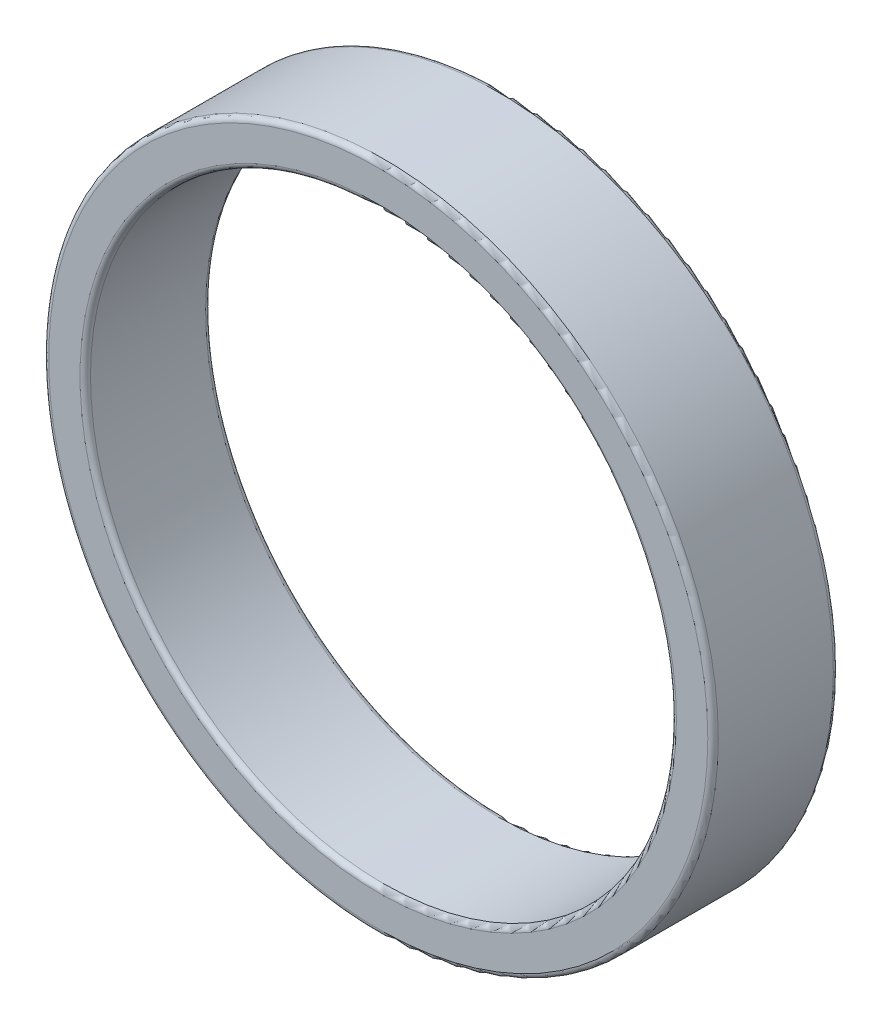
from build123d import *

# Parameters (mm, degrees)
SKETCH1_R           = 16
SKETCH1_R_2         = 14
EXTRUDE_THIN1_DEPTH = 6
FILLET1_R           = 0.25


with BuildPart() as part:
    # Sketch1 → Extrude-Thin1 (new body)
    with BuildSketch(Plane.XY):
        Circle(SKETCH1_R)
        Circle(SKETCH1_R_2, mode=Mode.SUBTRACT)
    extrude(amount=EXTRUDE_THIN1_DEPTH)

    # Fillet1
    fillet1_edges = [part.edges().sort_by_distance(p)[0] for p in [
        (-16, 0, 0),
        (-14, 0, 0),
        (-16, 0, 6),
        (-14, 0, 6),
    ]]
    fillet(fillet1_edges, radius=FILLET1_R)


solid = part.part
